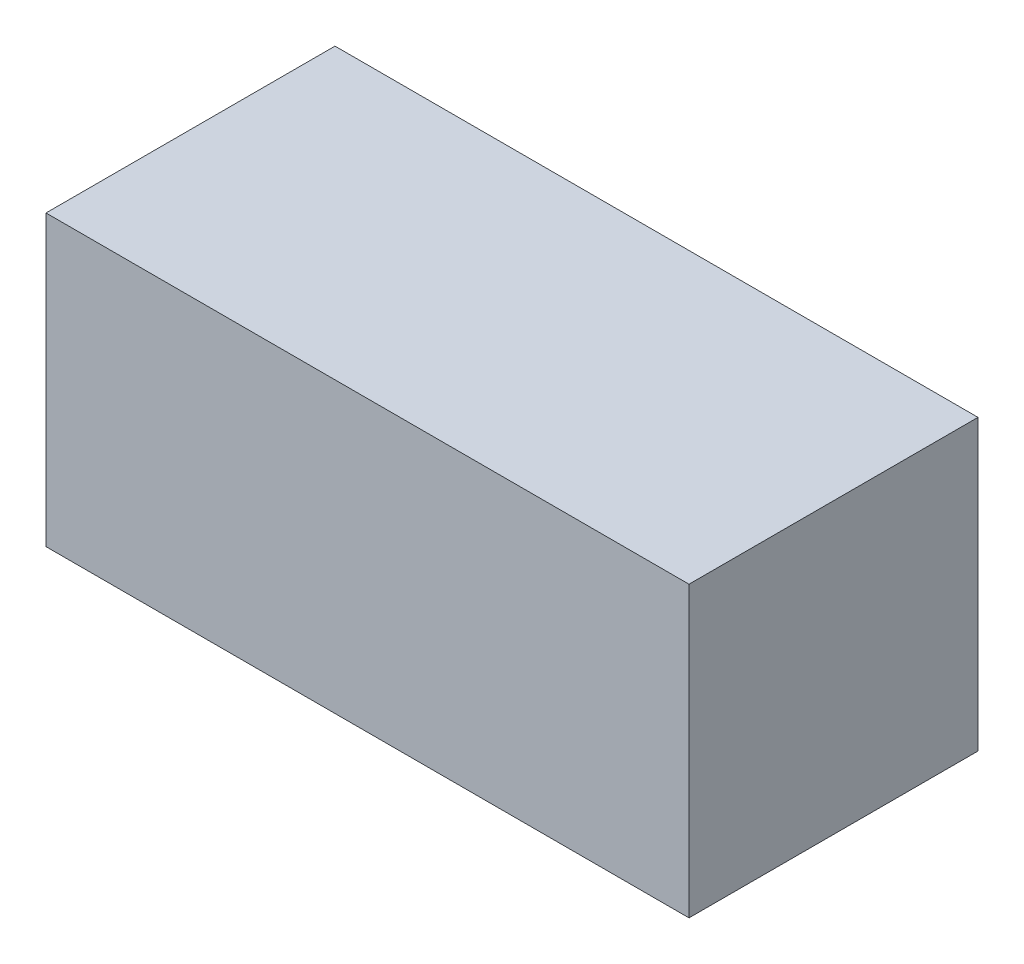
from build123d import *

# Parameters (mm, degrees)
SKETCH_1_W              = 2.225
SKETCH_1_H              = 1
COMPONENT_OUTLINE_DEPTH = 1


with BuildPart() as part:
    # 草图1 → Component_Outline (new body)
    with BuildSketch(Plane.XY):
        with Locations((0.0125, 0)):
            Rectangle(SKETCH_1_W, SKETCH_1_H)
    extrude(amount=COMPONENT_OUTLINE_DEPTH)


solid = part.part
